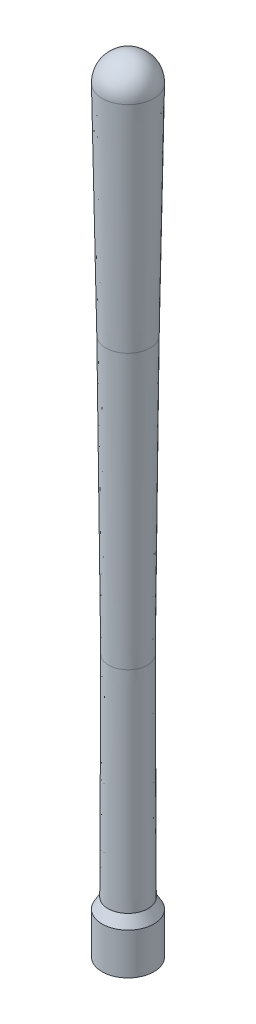
from build123d import *


with BuildPart() as part:
    # Sketch1 → Diafisis_y_cabeza (revolve)
    with BuildSketch(Plane.XY, mode=Mode.PRIVATE) as diafisis_y_cabeza_sk:
        Polygon((0, -8), (4.5, -8), (7.5, -6), (7.5, 6), (5.8, 9), (5.6, 70), (6.4, 150), (7.5, 213.424459704), (0, 213.424459704), align=None)
    revolve(diafisis_y_cabeza_sk.sketch.rotate(Axis((0, -12, 0), (0, 1, 0)), 90), axis=Axis((0, -12, 0), (0, 1, 0)))

    # Sketch2 → Extremo_proximal (revolve)
    with BuildSketch(Plane.XY):
        with BuildLine():
            Line((0, 205.924459704), (0, 220.924459704))
            ThreePointArc((0, 220.924459704), (7.5, 213.424459704), (0, 205.924459704))
        make_face()
    revolve(axis=Axis((0, 201.924459704, 0), (0, 1, 0)))


solid = part.part
